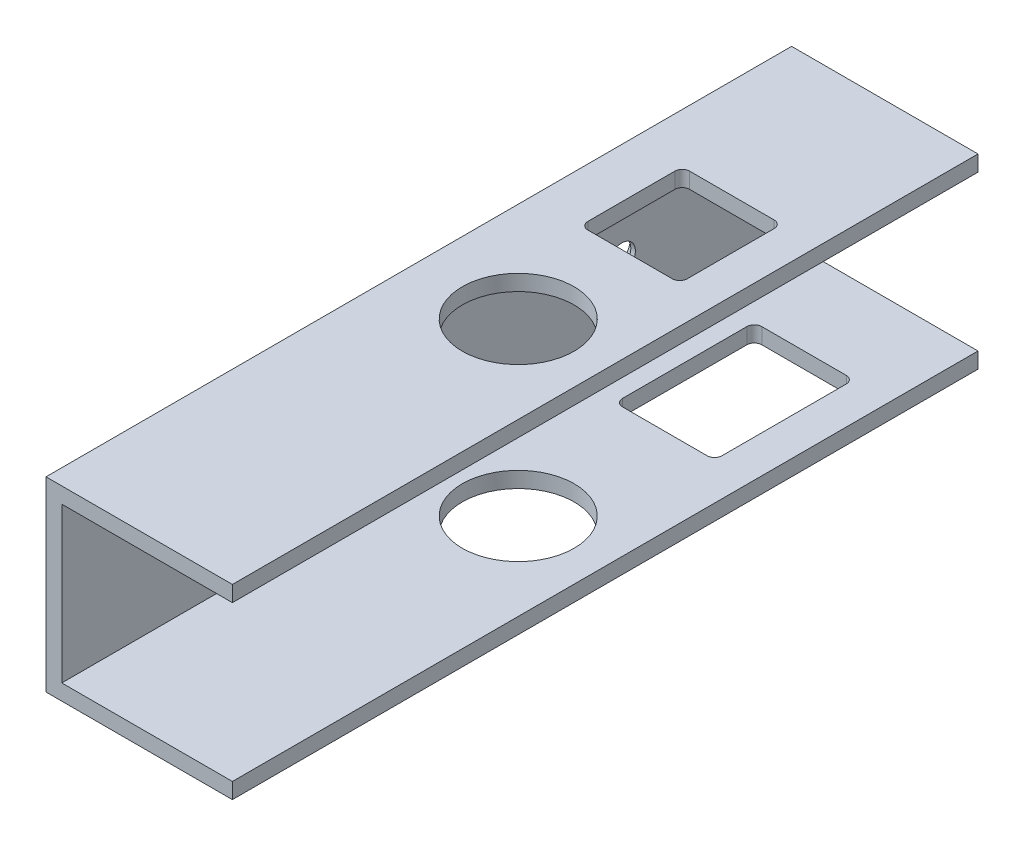
from build123d import *

# Parameters (mm, degrees)
BOSS_EXTRUDE1_DEPTH                                  = 300
SKETCH2_R                                            = 22.5
CUT_EXTRUDE1_DEPTH                                   = 319.198051534
SKETCH3_W                                            = 40
SKETCH3_H                                            = 56
CUT_EXTRUDE2_DEPTH                                   = 10
SKETCH4_W                                            = 40
SKETCH4_H                                            = 41
CUT_EXTRUDE3_DEPTH                                   = 10
FILLET1_R                                            = 3
CSK_FOR_M10_COUNTERSUNK_FLAT_HEAD_SCREW1_D           = 11
CSK_FOR_M10_COUNTERSUNK_FLAT_HEAD_SCREW1_DEPTH       = 20.003
CSK_FOR_M10_COUNTERSUNK_FLAT_HEAD_SCREW1_CSINK_D     = 20
CSK_FOR_M10_COUNTERSUNK_FLAT_HEAD_SCREW1_CSINK_ANGLE = 90
CSK_FOR_M10_COUNTERSUNK_FLAT_HEAD_SCREW1_TIP         = 3.304733405


with BuildPart() as part:
    # Sketch1 → Boss-Extrude1 (new body)
    with BuildSketch(Plane.XY):
        Polygon((0, -37.5), (0, 37.5), (75, 37.5), (75, 31.15), (6.35, 31.15), (6.35, -31.15), (75, -31.15), (75, -37.5), align=None)
    extrude(amount=BOSS_EXTRUDE1_DEPTH)

    # Sketch2 → Cut-Extrude1 (cut, through all)
    with BuildSketch(Plane(origin=(0, 37.5, 0), x_dir=(1, 0, 0), z_dir=(0, 1, 0))):
        with Locations(Location((40, -150, 0), (0, 0, 270))):
            Circle(SKETCH2_R)
    extrude(amount=-CUT_EXTRUDE1_DEPTH, mode=Mode.SUBTRACT)

    # Sketch3 → Cut-Extrude2 (cut)
    with BuildSketch(Plane.XZ.offset(37.5)):
        with Locations((40, 63)):
            Rectangle(SKETCH3_W, SKETCH3_H)
    extrude(amount=-CUT_EXTRUDE2_DEPTH, mode=Mode.SUBTRACT)

    # Sketch4 → Cut-Extrude3 (cut)
    with BuildSketch(Plane(origin=(0, 37.5, 0), x_dir=(1, 0, 0), z_dir=(0, 1, 0))):
        with Locations((40, -84.5)):
            Rectangle(SKETCH4_W, SKETCH4_H)
    extrude(amount=-CUT_EXTRUDE3_DEPTH, mode=Mode.SUBTRACT)

    # Fillet1
    fillet1_edges = [part.edges().sort_by_distance(p)[0] for p in [
        (20, -34.325, 91),
        (60, -34.325, 91),
        (60, -34.325, 35),
        (20, -34.325, 35),
        (60, 34.325, 105),
        (20, 34.325, 105),
        (20, 34.325, 64),
        (60, 34.325, 64),
    ]]
    fillet(fillet1_edges, radius=FILLET1_R)

    # CSK for M10 Countersunk Flat Head Screw1
    with Locations(Plane.ZY):
        with Locations((74.704121605, 4.01110333)):
            CounterSinkHole(CSK_FOR_M10_COUNTERSUNK_FLAT_HEAD_SCREW1_D / 2, CSK_FOR_M10_COUNTERSUNK_FLAT_HEAD_SCREW1_CSINK_D / 2, depth=CSK_FOR_M10_COUNTERSUNK_FLAT_HEAD_SCREW1_DEPTH, counter_sink_angle=CSK_FOR_M10_COUNTERSUNK_FLAT_HEAD_SCREW1_CSINK_ANGLE)
            with Locations((0, 0, -(CSK_FOR_M10_COUNTERSUNK_FLAT_HEAD_SCREW1_DEPTH + CSK_FOR_M10_COUNTERSUNK_FLAT_HEAD_SCREW1_TIP / 2))):  # 118° drill point
                Cone(0, CSK_FOR_M10_COUNTERSUNK_FLAT_HEAD_SCREW1_D / 2, CSK_FOR_M10_COUNTERSUNK_FLAT_HEAD_SCREW1_TIP, mode=Mode.SUBTRACT)


solid = part.part
